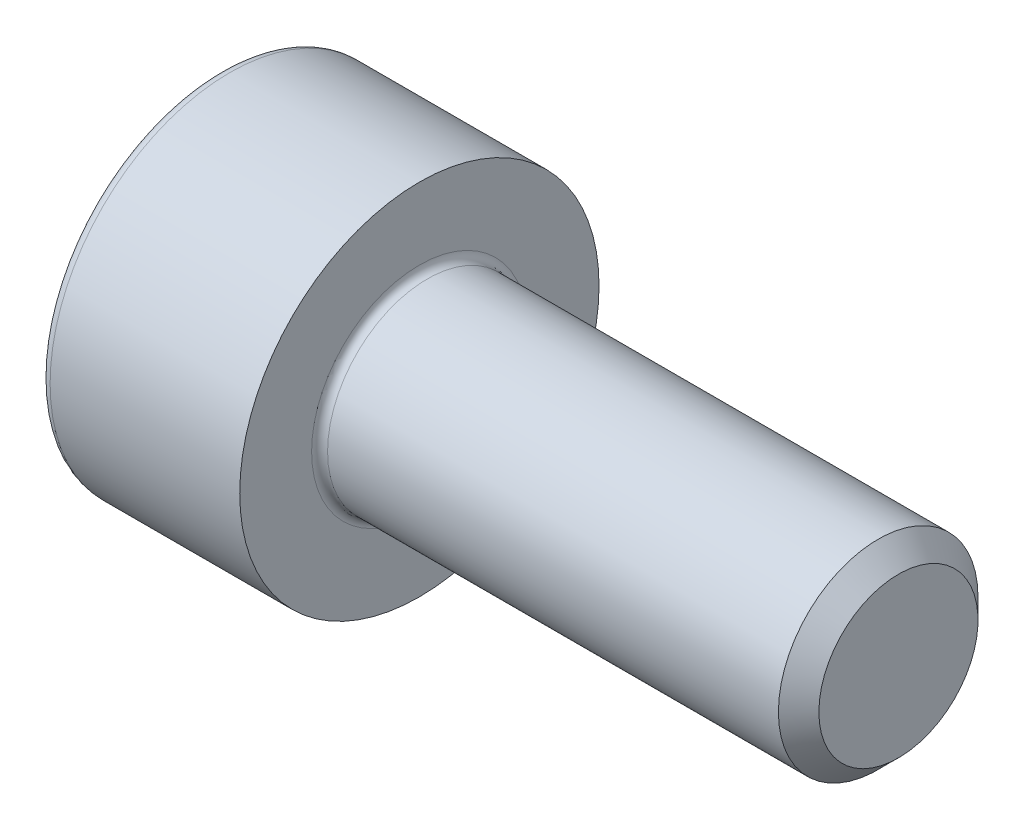
from build123d import *

# Parameters (mm, degrees)
FILLET1_R   = 0.1
FILLET2_R   = 0.125
HEX_2_DEPTH = 1.1


with BuildPart() as part:
    # BodySke → Base-Revolve (revolve)
    with BuildSketch(Plane.XY, mode=Mode.PRIVATE) as base_revolve_sk:
        Polygon((0, 0), (0, 2.25), (2.5, 2.25), (2.5, 1.25), (8.2465, 1.25), (8.5, 0.9965), (8.5, 0), align=None)
    revolve(base_revolve_sk.sketch.rotate(Axis((-31.75, 0, 0), (1, 0, 0)), 90), axis=Axis((-31.75, 0, 0), (1, 0, 0)))

    # Fillet1
    fillet1_edges = [part.edges().sort_by_distance(p)[0] for p in [
        (2.5, 0, -1.25),
    ]]
    fillet(fillet1_edges, radius=FILLET1_R)

    # Fillet2
    fillet2_edges = [part.edges().sort_by_distance(p)[0] for p in [
        (0, 0, -2.25),
    ]]
    fillet(fillet2_edges, radius=FILLET2_R)

    # Sketch2 → Hex-PreBroach (revolve, cut)
    with BuildSketch(Plane.XY, mode=Mode.PRIVATE) as hex_prebroach_sk:
        Polygon((0, 1.0225), (1.1, 1.0225), (1.69034065, 0), (0, 0), align=None)
    revolve(hex_prebroach_sk.sketch.rotate(Axis((0, 0, 0), (1, 0, 0)), 90), axis=Axis((0, 0, 0), (1, 0, 0)), mode=Mode.SUBTRACT)

    # Sketch3 → Hex 2 (cut)
    with BuildSketch(Plane(origin=(0, 0, 0), x_dir=(0, 0.500000000000001, 0.866025403784438), z_dir=(-1, 0, 0))):
        Polygon((0.59034065, 1.0225), (-0.59034065, 1.0225), (-1.1806813, 0), (-0.59034065, -1.0225), (0.59034065, -1.0225), (1.1806813, 0), align=None)
    extrude(amount=-HEX_2_DEPTH, mode=Mode.SUBTRACT)


solid = part.part
